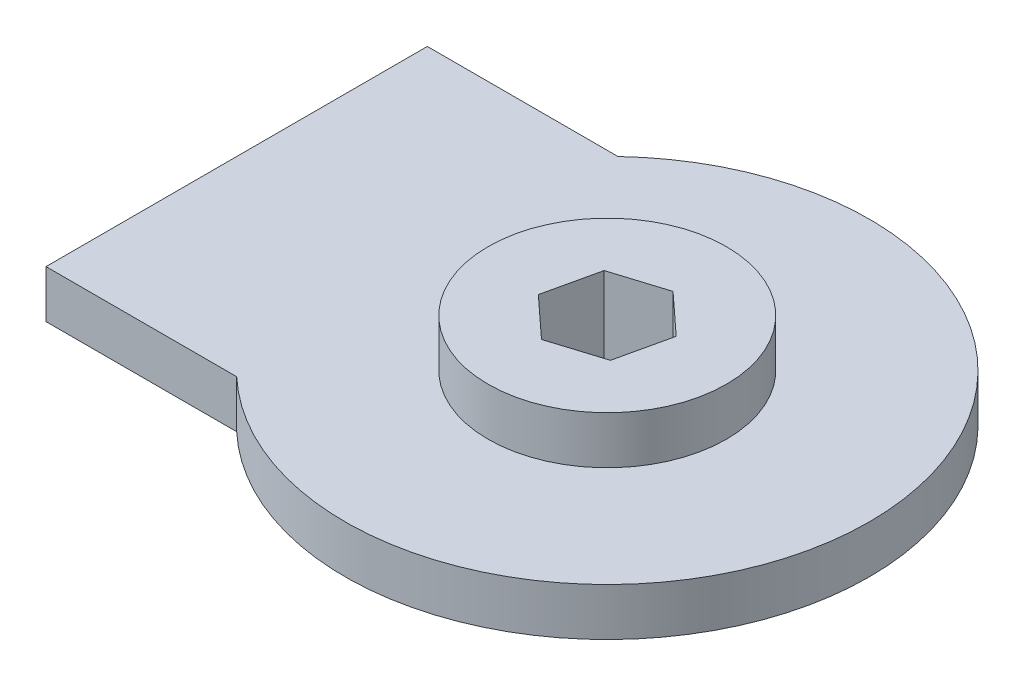
from build123d import *

# Parameters (mm, degrees)
SKETCH1_R           = 34.925
SKETCH1_W           = 25.4
SKETCH1_H           = 50.8
BOSS_EXTRUDE1_DEPTH = 6.35
SKETCH2_R           = 15.875
BOSS_EXTRUDE2_DEPTH = 6.35
CUT_EXTRUDE1_DEPTH  = 62.794126307


with BuildPart() as part:
    # Sketch1 → Boss-Extrude1 (new body)
    with BuildSketch(Plane(origin=(0, 0, 0), x_dir=(1, 0, 0), z_dir=(0, 1, 0))):
        Circle(SKETCH1_R)
        with Locations((-36.670724332, 0)):
            Rectangle(SKETCH1_W, SKETCH1_H)
    extrude(amount=BOSS_EXTRUDE1_DEPTH)

    # Sketch2 → Boss-Extrude2 (add)
    with BuildSketch(Plane(origin=(0, 6.35, 0), x_dir=(1, 0, 0), z_dir=(0, 1, 0))):
        with Locations(Location((0, 0, 0), (0, 0, 270))):
            Circle(SKETCH2_R)
    extrude(amount=BOSS_EXTRUDE2_DEPTH)

    # Sketch3 → Cut-Extrude1 (cut, through all)
    with BuildSketch(Plane(origin=(0, 12.7, 0), x_dir=(1, 0, 0), z_dir=(0, 1, 0))):
        Polygon((5.391213117, -4.969723781), (6.999513603, 2.184065626), (1.608300486, 7.153789407), (-5.391213117, 4.969723781), (-6.999513603, -2.184065626), (-1.608300486, -7.153789407), align=None)
    extrude(amount=-CUT_EXTRUDE1_DEPTH, mode=Mode.SUBTRACT)


solid = part.part
